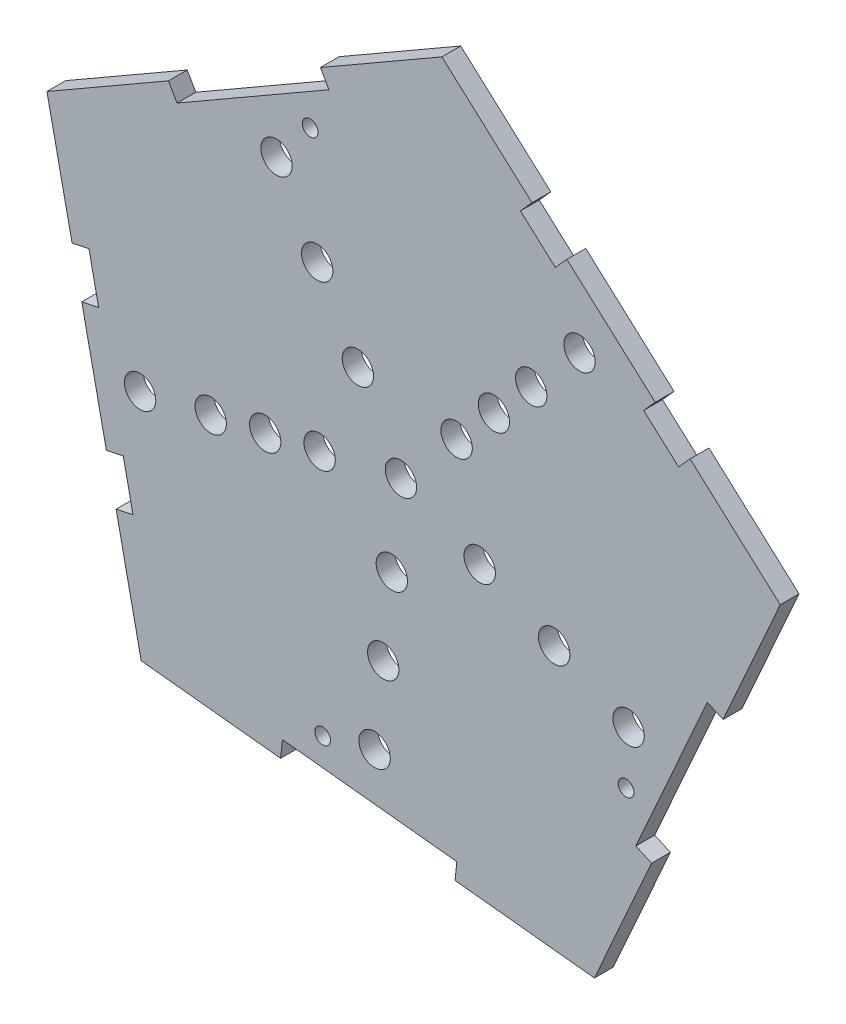
from build123d import *

# Parameters (mm, degrees)
BOSS_EXTRUDE1_DEPTH = 6
SKETCH2_R           = 5
CUT_EXTRUDE1_DEPTH  = 6
SKETCH11_R          = 4.999999998
CUT_EXTRUDE2_DEPTH  = 10
SKETCH12_R          = 5
SKETCH12_R_2        = 2.5
CUT_EXTRUDE3_DEPTH  = 10
CUT_EXTRUDE4_DEPTH  = 10
CUT_EXTRUDE5_DEPTH  = 10
BOSS_EXTRUDE2_START = -6
SKETCH14_R          = 2.5
BOSS_EXTRUDE2_DEPTH = 6
SKETCH14_3_R        = 2.5
CUT_EXTRUDE6_DEPTH  = 6
SKETCH11_4_R        = 4.999999998
BOSS_EXTRUDE3_DEPTH = 6


with BuildPart() as part:
    # Sketch1 → Boss-Extrude1 (new body)
    with BuildSketch(Plane.XY):
        Polygon((-82.808015356, -91.768584182), (61.688025962, -107.113154668), (120.9333121, 25.569013955), (13.052871288, 122.915674351), (-112.866193993, 50.397050544), align=None)
    extrude(amount=BOSS_EXTRUDE1_DEPTH)

    # Sketch2 → Cut-Extrude1 (cut)
    with BuildSketch(Plane.XY.offset(6)):
        Circle(SKETCH2_R)
    extrude(amount=-CUT_EXTRUDE1_DEPTH, mode=Mode.SUBTRACT)

    # Sketch11 → Cut-Extrude2 (cut)
    with BuildSketch(Plane.XY.offset(6)):
        with Locations((-6.54719671, -61.653339044)):
            Circle(SKETCH11_R)
        with Locations((-4.672797652, -44.002584721)):
            Circle(SKETCH11_R)
        with Locations((-2.798398593, -26.351830398)):
            Circle(SKETCH11_R)
        with Locations((-8.975995491, -84.524739011)):
            Circle(SKETCH11_R)
    cut_extrude2 = extrude(amount=-CUT_EXTRUDE2_DEPTH, mode=Mode.SUBTRACT)

    # Sketch12 → Cut-Extrude3 (cut)
    with BuildSketch(Plane.XY.offset(6)):
        with Locations((48.851207931, -21.813057641)):
            Circle(SKETCH12_R)
        with Locations((25.110433983, -11.212319348)):
            Circle(SKETCH12_R)
        with Locations((84.822429951, -20.352343286)):
            Circle(SKETCH12_R_2)
        with Locations((72.591981879, -32.413795933)):
            Circle(SKETCH12_R)
    cut_extrude3 = extrude(amount=-CUT_EXTRUDE3_DEPTH, mode=Mode.SUBTRACT)

    # Sketch11<3> → Cut-Extrude4 (cut)
    with BuildSketch(Plane.XY.offset(6)):
        Polygon((8.29449613, -101.443097727), (8.875295839, -95.973849909), (23.791426251, -97.557849113), (23.210626543, -103.027096932), align=None)
        Polygon((-29.414485521, -97.438641123), (-28.833685813, -91.969393305), (-43.749816225, -90.3853941), (-44.330615934, -95.854641919), align=None)
    cut_extrude4 = extrude(amount=-CUT_EXTRUDE4_DEPTH, mode=Mode.SUBTRACT)

    # Mirror3: Cut-Extrude2 across plane
    add(cut_extrude2.mirror(Plane(origin=(0, 0, 0), x_dir=(0, 0, 1), z_dir=(-0.4077207035645653, -0.9131066903077734, 0))), mode=Mode.SUBTRACT)

    # Mirror4: Cut-Extrude3 across plane
    add(cut_extrude3.mirror(Plane(origin=(0, 0, 0), x_dir=(0, 0, 1), z_dir=(0.742423441529948, -0.6699309169360882, 0))), mode=Mode.SUBTRACT)

    # Mirror5: Cut-Extrude2 across plane
    add(cut_extrude2.mirror(Plane(origin=(0, 0, 0), x_dir=(0, 0, 1), z_dir=(0.742423441529948, -0.6699309169360882, 0))), mode=Mode.SUBTRACT)

    # Mirror6: Cut-Extrude4 across plane
    add(cut_extrude4.mirror(Plane(origin=(0, 0, 0), x_dir=(0, 0, 1), z_dir=(-0.4077207035645653, -0.9131066903077734, 0))), mode=Mode.SUBTRACT)

    # Mirror7: Cut-Extrude4 across plane
    add(cut_extrude4.mirror(Plane(origin=(0, 0, 0), x_dir=(0, 0, 1), z_dir=(0.742423441529948, -0.6699309169360882, 0))), mode=Mode.SUBTRACT)

    # Sketch13 → Cut-Extrude5 (cut)
    with BuildSketch(Plane.XY.offset(6)):
        Polygon((79.910592339, -66.30299436), (102.710745723, -15.241146353), (97.688658926, -12.998682483), (74.888505542, -64.060530491), align=None)
    cut_extrude5 = extrude(amount=-CUT_EXTRUDE5_DEPTH, mode=Mode.SUBTRACT)

    # Mirror8: Cut-Extrude5 across plane
    add(cut_extrude5.mirror(Plane(origin=(0, 0, 0), x_dir=(0, 0, 1), z_dir=(0.742423441529948, -0.6699309169360882, 0))), mode=Mode.SUBTRACT)

    # Sketch14 → Boss-Extrude2 (add)
    with BuildSketch(Plane(origin=(0, 0, 0), x_dir=(-1, 0, 0), z_dir=(0, 0, -1)).offset(BOSS_EXTRUDE2_START)):
        with Locations((-84.822429951, -20.352343286)):
            Circle(SKETCH14_R)
    extrude(amount=BOSS_EXTRUDE2_DEPTH)

    # Sketch14<3> → Cut-Extrude6 (cut)
    with BuildSketch(Plane(origin=(0, 0, 0), x_dir=(-1, 0, 0), z_dir=(0, 0, -1))):
        with Locations((-71.775367437, -49.571757376)):
            Circle(SKETCH14_3_R)
    extrude(amount=-CUT_EXTRUDE6_DEPTH, mode=Mode.SUBTRACT)

    # Sketch11<4> → Boss-Extrude3 (add)
    with BuildSketch(Plane.XY.offset(6)):
        Polygon((8.875295839, -95.973849909), (8.29449613, -101.443097727), (23.210626543, -103.027096932), (23.791426251, -97.557849113), align=None)
        Polygon((-44.330615934, -95.854641919), (-29.414485521, -97.438641123), (-28.833685813, -91.969393305), (-43.749816225, -90.3853941), align=None)
        with Locations((-6.54719671, -61.653339044)):
            Circle(SKETCH11_4_R)
        with Locations((-4.672797652, -44.002584721)):
            Circle(SKETCH11_4_R)
        with Locations((-2.798398593, -26.351830398)):
            Circle(SKETCH11_4_R)
        with Locations((-8.975995491, -84.524739011)):
            Circle(SKETCH11_4_R)
    extrude(amount=-BOSS_EXTRUDE3_DEPTH)

    # Mirror9: Cut-Extrude3, Cut-Extrude5 across plane
    add(cut_extrude3.mirror(Plane(origin=(0, 0, 0), x_dir=(0, 0, 1), z_dir=(0.8665636244747431, 0.4990666135268884, 0))), mode=Mode.SUBTRACT)
    add(cut_extrude5.mirror(Plane(origin=(0, 0, 0), x_dir=(0, 0, 1), z_dir=(0.8665636244747431, 0.4990666135268884, 0))), mode=Mode.SUBTRACT)


solid = part.part
